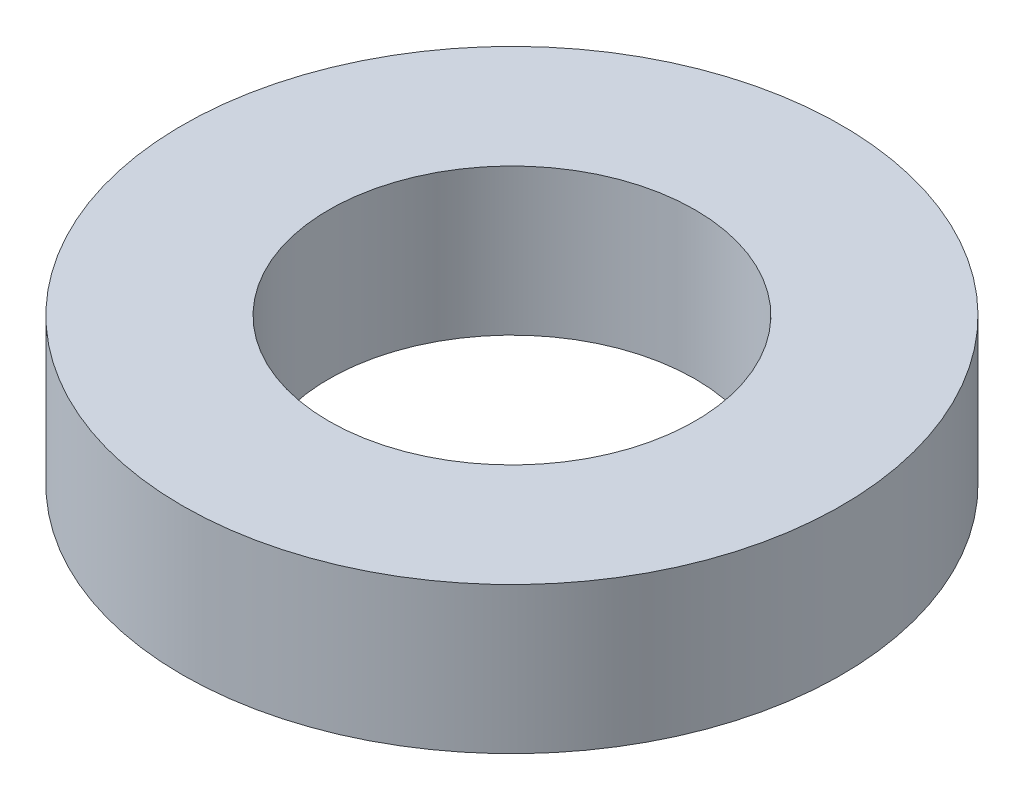
from build123d import *

# Parameters (mm, degrees)
CROQUIS1_R              = 7.14375
CROQUIS1_R_2            = 3.96875
SALIENTE_EXTRUIR1_DEPTH = 3.175


with BuildPart() as part:
    # Croquis1 → Saliente-Extruir1 (new body)
    with BuildSketch(Plane(origin=(0, 0, 0), x_dir=(1, 0, 0), z_dir=(0, 1, 0))):
        with Locations(Location((0, 0, 0), (0, 0, 270))):
            Circle(CROQUIS1_R)
        with Locations(Location((0, 0, 0), (0, 0, 270))):
            Circle(CROQUIS1_R_2, mode=Mode.SUBTRACT)
    extrude(amount=SALIENTE_EXTRUIR1_DEPTH)


solid = part.part
